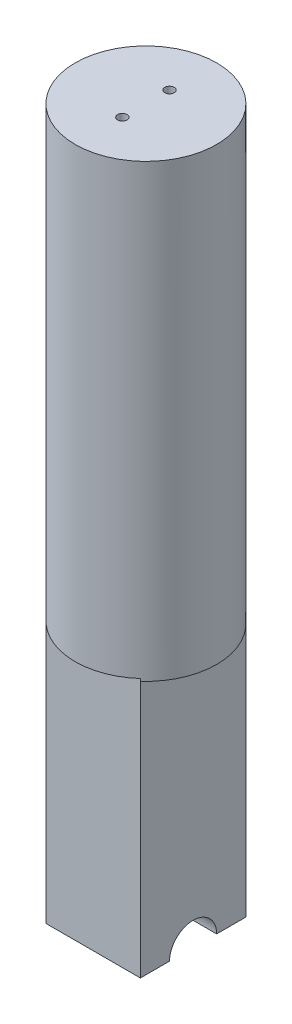
from build123d import *

# Parameters (mm, degrees)
SKETCH2_R           = 15
BOSS_EXTRUDE1_DEPTH = 150
CUT_EXTRUDE1_START  = 10
SKETCH3_W           = 30
SKETCH3_H           = 108.98871412
CUT_EXTRUDE1_DEPTH  = 100
CUT_EXTRUDE2_START  = -10
SKETCH3_2_W         = 30
SKETCH3_2_H         = 108.98871412
CUT_EXTRUDE2_DEPTH  = 100
CUT_EXTRUDE4_DEPTH  = 55
SKETCH4_R           = 5
CUT_EXTRUDE5_DEPTH  = 153.807067899
SKETCH6_R           = 1
CUT_EXTRUDE6_DEPTH  = 8


with BuildPart() as part:
    # Sketch2 → Boss-Extrude1 (new body)
    with BuildSketch(Plane(origin=(0, 0, 0), x_dir=(1, 0, 0), z_dir=(0, 1, 0))):
        Circle(SKETCH2_R)
    extrude(amount=BOSS_EXTRUDE1_DEPTH)

    # Sketch3 → Cut-Extrude1 (cut)
    with BuildSketch(Plane(origin=(0, 0, 0), x_dir=(0, 0, -1), z_dir=(1, 0, 0)).offset(CUT_EXTRUDE1_START)):
        Rectangle(SKETCH3_W, SKETCH3_H)
    extrude(amount=CUT_EXTRUDE1_DEPTH, mode=Mode.SUBTRACT)

    # Sketch3<2> → Cut-Extrude2 (cut)
    with BuildSketch(Plane(origin=(0, 0, 0), x_dir=(0, 0, -1), z_dir=(1, 0, 0)).offset(CUT_EXTRUDE2_START)):
        Rectangle(SKETCH3_2_W, SKETCH3_2_H)
    extrude(amount=-CUT_EXTRUDE2_DEPTH, mode=Mode.SUBTRACT)

    # Sketch5 → Cut-Extrude4 (cut)
    with BuildSketch(Plane.XZ):
        with BuildLine():
            Line((-10, 11.180339887), (10, 11.180339887))
            ThreePointArc((10, 11.180339887), (0, 15), (-10, 11.180339887))
        make_face()
        with BuildLine():
            Line((-10, -11.180339887), (10, -11.180339887))
            ThreePointArc((10, -11.180339887), (0, -15), (-10, -11.180339887))
        make_face()
    extrude(amount=-CUT_EXTRUDE4_DEPTH, mode=Mode.SUBTRACT)

    # Sketch4 → Cut-Extrude5 (cut, through all)
    with BuildSketch(Plane(origin=(10, 0, 0), x_dir=(0, 0, -1), z_dir=(1, 0, 0))):
        with Locations((0.000339887, 0)):
            Circle(SKETCH4_R)
    extrude(amount=-CUT_EXTRUDE5_DEPTH, mode=Mode.SUBTRACT)

    # Sketch6 → Cut-Extrude6 (cut)
    with BuildSketch(Plane(origin=(0, 150, 0), x_dir=(1, 0, 0), z_dir=(0, 1, 0))):
        with Locations((0, 5)):
            Circle(SKETCH6_R)
        with Locations((0, -5)):
            Circle(SKETCH6_R)
    extrude(amount=-CUT_EXTRUDE6_DEPTH, mode=Mode.SUBTRACT)


solid = part.part
